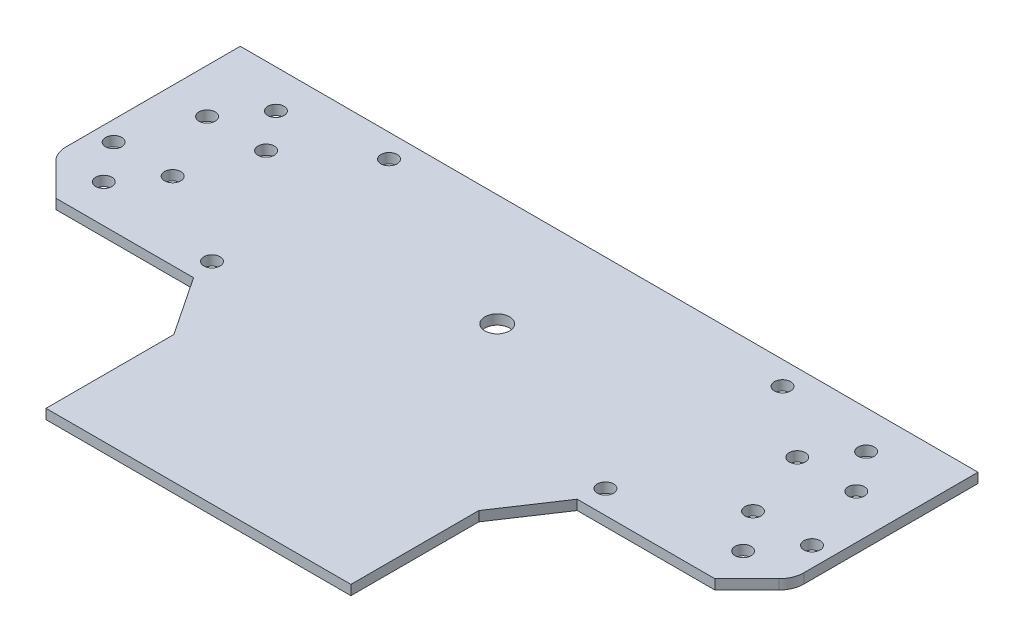
from build123d import *

# Parameters (mm, degrees)
SKETCH_1_W             = 150
SKETCH_1_H             = 45.5
EXTRUDE_1_DEPTH        = 2
CUT_EXTRUDE_1_REACH    = 80.4
SKETCH_2_R             = 1.65
CHAMFER_1_SIZE         = 8
CUT_EXTRUDE_1139_REACH = 80.4
SKETCH_3_R             = 2.5
CUT_EXTRUDE_2_REACH    = 80.4
SKETCH_4_R             = 1.65
FILLET_1_R             = 5
SKETCH_5_W             = 62
SKETCH_5_H             = 38
EXTRUDE_2_DEPTH        = 2
EXTRUDE_3_DEPTH        = 2


with BuildPart() as part:
    # 草图1 → 凸台-拉伸1 (new body)
    with BuildSketch(Plane(origin=(0, 0, 0), x_dir=(1, 0, 0), z_dir=(0, 1, 0))):
        Rectangle(SKETCH_1_W, SKETCH_1_H)
    extrude(amount=EXTRUDE_1_DEPTH)

    # 草图2 → 切除-拉伸1 (cut, up to next)
    with BuildSketch(Plane(origin=(0, 2, 0), x_dir=(1, 0, 0), z_dir=(0, 1, 0)), mode=Mode.PRIVATE) as cut_extrude_1_sk1:
        with Locations(Location((-60, 15, 0), (0, 0, 270))):
            Circle(SKETCH_2_R)
    cut_extrude_1_tool1 = extrude(cut_extrude_1_sk1.sketch, amount=-CUT_EXTRUDE_1_REACH, mode=Mode.PRIVATE) & part.part
    # 草图2 → 切除-拉伸1 (cut, up to next)
    with BuildSketch(Plane(origin=(0, 2, 0), x_dir=(1, 0, 0), z_dir=(0, 1, 0)), mode=Mode.PRIVATE) as cut_extrude_1_sk2:
        with Locations(Location((-66, 7, 0), (0, 0, 270))):
            Circle(SKETCH_2_R)
    cut_extrude_1_tool2 = extrude(cut_extrude_1_sk2.sketch, amount=-CUT_EXTRUDE_1_REACH, mode=Mode.PRIVATE) & part.part
    # 草图2 → 切除-拉伸1 (cut, up to next)
    with BuildSketch(Plane(origin=(0, 2, 0), x_dir=(1, 0, 0), z_dir=(0, 1, 0)), mode=Mode.PRIVATE) as cut_extrude_1_sk3:
        with Locations(Location((-54, 7, 0), (0, 0, 270))):
            Circle(SKETCH_2_R)
    cut_extrude_1_tool3 = extrude(cut_extrude_1_sk3.sketch, amount=-CUT_EXTRUDE_1_REACH, mode=Mode.PRIVATE) & part.part
    # 草图2 → 切除-拉伸1 (cut, up to next)
    with BuildSketch(Plane(origin=(0, 2, 0), x_dir=(1, 0, 0), z_dir=(0, 1, 0)), mode=Mode.PRIVATE) as cut_extrude_1_sk4:
        with Locations(Location((-71, -7, 0), (0, 0, 270))):
            Circle(SKETCH_2_R)
    cut_extrude_1_tool4 = extrude(cut_extrude_1_sk4.sketch, amount=-CUT_EXTRUDE_1_REACH, mode=Mode.PRIVATE) & part.part
    # 草图2 → 切除-拉伸1 (cut, up to next)
    with BuildSketch(Plane(origin=(0, 2, 0), x_dir=(1, 0, 0), z_dir=(0, 1, 0)), mode=Mode.PRIVATE) as cut_extrude_1_sk5:
        with Locations(Location((-59, -7, 0), (0, 0, 270))):
            Circle(SKETCH_2_R)
    cut_extrude_1_tool5 = extrude(cut_extrude_1_sk5.sketch, amount=-CUT_EXTRUDE_1_REACH, mode=Mode.PRIVATE) & part.part
    # 草图2 → 切除-拉伸1 (cut, up to next)
    with BuildSketch(Plane(origin=(0, 2, 0), x_dir=(1, 0, 0), z_dir=(0, 1, 0)), mode=Mode.PRIVATE) as cut_extrude_1_sk6:
        with Locations(Location((-65, -15, 0), (0, 0, 270))):
            Circle(SKETCH_2_R)
    cut_extrude_1_tool6 = extrude(cut_extrude_1_sk6.sketch, amount=-CUT_EXTRUDE_1_REACH, mode=Mode.PRIVATE) & part.part
    cut_extrude_1_1 = cut_extrude_1_tool1.solids().sort_by_distance((-60, 2, -15))[0]
    add(cut_extrude_1_1, mode=Mode.SUBTRACT)
    cut_extrude_1_2 = cut_extrude_1_tool2.solids().sort_by_distance((-66, 2, -7))[0]
    add(cut_extrude_1_2, mode=Mode.SUBTRACT)
    cut_extrude_1_3 = cut_extrude_1_tool3.solids().sort_by_distance((-54, 2, -7))[0]
    add(cut_extrude_1_3, mode=Mode.SUBTRACT)
    cut_extrude_1_4 = cut_extrude_1_tool4.solids().sort_by_distance((-71, 2, 7))[0]
    add(cut_extrude_1_4, mode=Mode.SUBTRACT)
    cut_extrude_1_5 = cut_extrude_1_tool5.solids().sort_by_distance((-59, 2, 7))[0]
    add(cut_extrude_1_5, mode=Mode.SUBTRACT)
    cut_extrude_1_6 = cut_extrude_1_tool6.solids().sort_by_distance((-65, 2, 15))[0]
    add(cut_extrude_1_6, mode=Mode.SUBTRACT)
    cut_extrude_1 = cut_extrude_1_1 + cut_extrude_1_2 + cut_extrude_1_3 + cut_extrude_1_4 + cut_extrude_1_5 + cut_extrude_1_6  # 切除-拉伸1 as one shape, for the pattern or mirror that repeats it

    # 镜向1: 切除-拉伸1 across plane
    add(cut_extrude_1.mirror(Plane(origin=(0, 0, 0), x_dir=(0, 0, 1), z_dir=(1, 0, 0))), mode=Mode.SUBTRACT)

    # 倒角1
    chamfer_1_edges = [part.edges().sort_by_distance(p)[0] for p in [
        (75, 1, 22.75),
        (-75, 1, 22.75),
    ]]
    chamfer(chamfer_1_edges, length=CHAMFER_1_SIZE)

    # 草图3 → Cut-Extrude 1139 (cut, up to next)
    with BuildSketch(Plane(origin=(0, 2, 0), x_dir=(1, 0, 0), z_dir=(0, 1, 0)), mode=Mode.PRIVATE) as cut_extrude_1139_sk1:
        with Locations(Location((0, 0, 0), (0, 0, 270))):
            Circle(SKETCH_3_R)
    cut_extrude_1139_tool1 = extrude(cut_extrude_1139_sk1.sketch, amount=-CUT_EXTRUDE_1139_REACH, mode=Mode.PRIVATE) & part.part
    add(cut_extrude_1139_tool1.solids().sort_by_distance((0, 2, 0))[0], mode=Mode.SUBTRACT)

    # 草图4 → 切除-拉伸2 (cut, up to next)
    with BuildSketch(Plane(origin=(0, 2, 0), x_dir=(1, 0, 0), z_dir=(0, 1, 0)), mode=Mode.PRIVATE) as cut_extrude_2_sk1:
        with Locations(Location((-40, 18, 0), (0, 0, 270))):
            Circle(SKETCH_4_R)
    cut_extrude_2_tool1 = extrude(cut_extrude_2_sk1.sketch, amount=-CUT_EXTRUDE_2_REACH, mode=Mode.PRIVATE) & part.part
    # 草图4 → 切除-拉伸2 (cut, up to next)
    with BuildSketch(Plane(origin=(0, 2, 0), x_dir=(1, 0, 0), z_dir=(0, 1, 0)), mode=Mode.PRIVATE) as cut_extrude_2_sk2:
        with Locations(Location((-40, -18, 0), (0, 0, 270))):
            Circle(SKETCH_4_R)
    cut_extrude_2_tool2 = extrude(cut_extrude_2_sk2.sketch, amount=-CUT_EXTRUDE_2_REACH, mode=Mode.PRIVATE) & part.part
    # 草图4 → 切除-拉伸2 (cut, up to next)
    with BuildSketch(Plane(origin=(0, 2, 0), x_dir=(1, 0, 0), z_dir=(0, 1, 0)), mode=Mode.PRIVATE) as cut_extrude_2_sk3:
        with Locations(Location((40, 18, 0), (0, 0, 270))):
            Circle(SKETCH_4_R)
    cut_extrude_2_tool3 = extrude(cut_extrude_2_sk3.sketch, amount=-CUT_EXTRUDE_2_REACH, mode=Mode.PRIVATE) & part.part
    # 草图4 → 切除-拉伸2 (cut, up to next)
    with BuildSketch(Plane(origin=(0, 2, 0), x_dir=(1, 0, 0), z_dir=(0, 1, 0)), mode=Mode.PRIVATE) as cut_extrude_2_sk4:
        with Locations(Location((40, -18, 0), (0, 0, 270))):
            Circle(SKETCH_4_R)
    cut_extrude_2_tool4 = extrude(cut_extrude_2_sk4.sketch, amount=-CUT_EXTRUDE_2_REACH, mode=Mode.PRIVATE) & part.part
    add(cut_extrude_2_tool1.solids().sort_by_distance((-40, 2, -18))[0], mode=Mode.SUBTRACT)
    add(cut_extrude_2_tool2.solids().sort_by_distance((-40, 2, 18))[0], mode=Mode.SUBTRACT)
    add(cut_extrude_2_tool3.solids().sort_by_distance((40, 2, -18))[0], mode=Mode.SUBTRACT)
    add(cut_extrude_2_tool4.solids().sort_by_distance((40, 2, 18))[0], mode=Mode.SUBTRACT)

    # 圆角1
    fillet_1_edges = [part.edges().sort_by_distance(p)[0] for p in [
        (75, 1, 14.75),
        (-75, 1, 14.75),
    ]]
    fillet(fillet_1_edges, radius=FILLET_1_R)

    # 草图5 → 凸台-拉伸2 (add)
    with BuildSketch(Plane(origin=(0, 0, 0), x_dir=(1, 0, 0), z_dir=(0, 1, 0))):
        with Locations((0, -41.75)):
            Rectangle(SKETCH_5_W, SKETCH_5_H)
    extrude(amount=EXTRUDE_2_DEPTH)

    # 草图6 → 凸台-拉伸3 (add)
    with BuildSketch(Plane(origin=(0, 0, 0), x_dir=(1, 0, 0), z_dir=(0, 1, 0))):
        Polygon((-31, -22.75), (-31, -34.75), (-39, -22.75), align=None)
        Polygon((31, -22.75), (31, -34.75), (39, -22.75), align=None)
    extrude(amount=EXTRUDE_3_DEPTH)


solid = part.part
